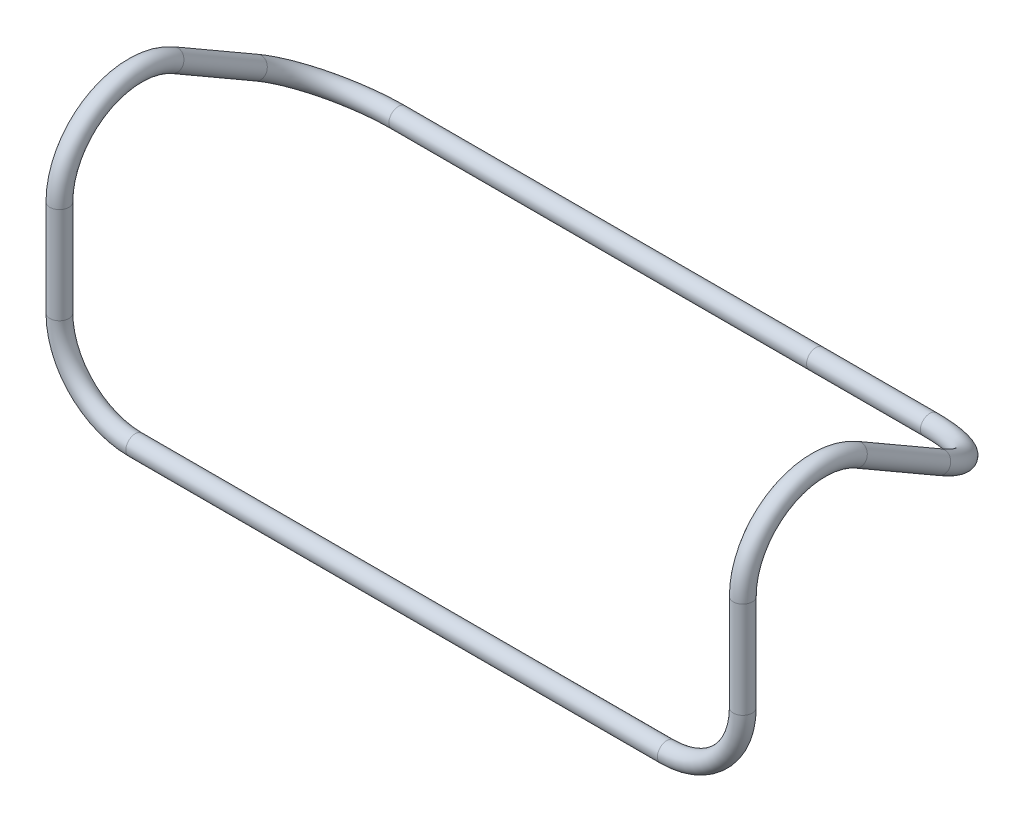
from build123d import *

# Parameters (mm, degrees)
SKETCH_3_R = 2.5


with BuildPart() as part:
    # 扫描1: sweep along a curve in space
    with BuildLine() as sweep_1_path:
        Line((0, 20, 0), (0, 45.358983849, 0))
        ThreePointArc((0, 45.358983849, 0), (0, 62.679491924, -10), (0, 62.679491924, -30))
        Line((0, 62.679491924, -30), (0, 50, -51.961524227))
        ThreePointArc((0, 50, -51.961524227), (-5.857864376, 42.928932188, -64.208972941), (-20, 40, -69.282032303))
        Line((-20, 40, -69.282032303), (-160, 40, -69.282032303))
        ThreePointArc((-180, 50, -51.961524227), (-174.142135624, 42.928932188, -64.208972941), (-160, 40, -69.282032303))
        Line((-180, 50, -51.961524227), (-180, 62.679491924, -30))
        ThreePointArc((-180, 62.679491924, -30), (-180, 62.679491924, -10), (-180, 45.358983849, 0))
        Line((-180, 45.358983849, 0), (-180, 20, 0))
        ThreePointArc((-180, 20, 0), (-174.142135624, 5.857864376, 0), (-160, 0, 0))
        Line((-160, 0, 0), (-20, 0, 0))
        ThreePointArc((-20, 0, 0), (-5.857864376, 5.857864376, 0), (0, 20, 0))
    # 草图3 → 扫描1 (sweep)
    with BuildSketch(Plane(origin=(-50, 0, 0), x_dir=(0, 0, -1), z_dir=(1, 0, 0))):
        with Locations((69.282032303, 40)):
            Circle(SKETCH_3_R)
    sweep(path=sweep_1_path.line)


solid = part.part
